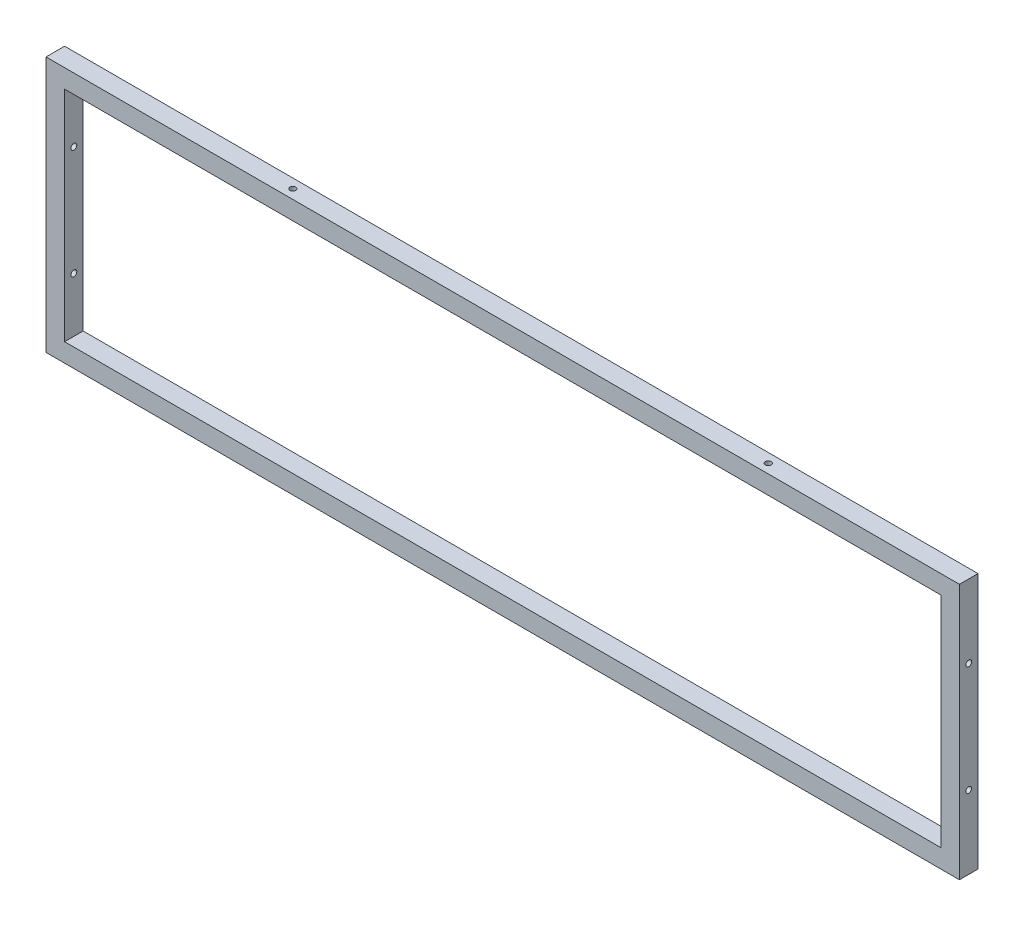
from build123d import *

# Parameters (mm, degrees)
SKETCH1_W           = 1249.2
SKETCH1_H           = 350
SKETCH1_W_2         = 1198.4
SKETCH1_H_2         = 299.2
BOSS_EXTRUDE1_DEPTH = 25.4
SKETCH2_R           = 4
CUT_EXTRUDE3_DEPTH  = 25.4
SKETCH3_R           = 4
CUT_EXTRUDE10_DEPTH = 5341.4


with BuildPart() as part:
    # Sketch1 → Boss-Extrude1 (new body)
    with BuildSketch(Plane.XY):
        with Locations((624.6, -175)):
            Rectangle(SKETCH1_W, SKETCH1_H)
        with Locations((624.6, -175)):
            Rectangle(SKETCH1_W_2, SKETCH1_H_2, mode=Mode.SUBTRACT)
    extrude(amount=-BOSS_EXTRUDE1_DEPTH)

    # Sketch2 → Cut-Extrude3 (cut)
    with BuildSketch(Plane(origin=(0, 0, 0), x_dir=(1, 0, 0), z_dir=(0, 1, 0))):
        with Locations(Location((325, 12.7, 0), (0, 0, 270))):
            Circle(SKETCH2_R)
        with Locations(Location((975.054095101, 12.7, 0), (0, 0, 270))):
            Circle(SKETCH2_R)
    extrude(amount=-CUT_EXTRUDE3_DEPTH, mode=Mode.SUBTRACT)

    # Sketch3 → Cut-Extrude10 (cut)
    with BuildSketch(Plane(origin=(0, 0, 0), x_dir=(0, 0, -1), z_dir=(1, 0, 0))):
        with Locations(Location((12.7, -100, 0), (0, 0, 180))):
            Circle(SKETCH3_R)
        with Locations(Location((12.7, -250, 0), (0, 0, 180))):
            Circle(SKETCH3_R)
    extrude(amount=CUT_EXTRUDE10_DEPTH, mode=Mode.SUBTRACT)


solid = part.part
